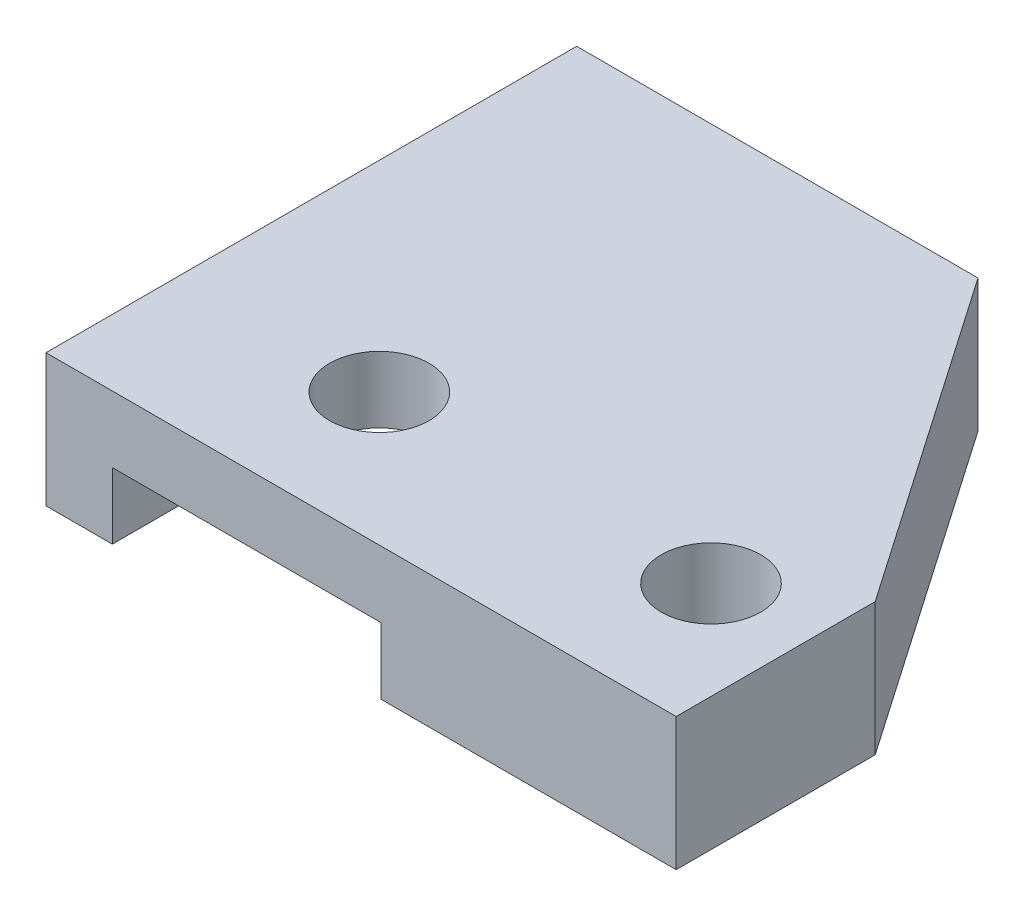
from build123d import *

# Parameters (mm, degrees)
BOSS_EXTRU_1_DEPTH      = 16
ESQUISSE2_R             = 1.5
ENL_V_MAT_EXTRU_1_DEPTH = 26.159491251


with BuildPart() as part:
    # Esquisse1 → Boss.-Extru.1 (new body)
    with BuildSketch(Plane.XY):
        Polygon((10.1, -4), (19, -4), (19, 0), (0, 0), (0, -4), (2, -4), (2, -2), (10.1, -2), align=None)
    extrude(amount=BOSS_EXTRU_1_DEPTH)

    # Esquisse2 → Enlèv. mat.-Extru.1 (cut, through all)
    with BuildSketch(Plane(origin=(0, 0, 0), x_dir=(1, 0, 0), z_dir=(0, 1, 0))):
        with Locations(Location((6.05, -12, 0), (0, 0, 270))):
            Circle(ESQUISSE2_R)
        with Locations(Location((16.05, -12, 0), (0, 0, 270))):
            Circle(ESQUISSE2_R)
        Polygon((12.1, 0), (19, 0), (19, -10), align=None)
    extrude(amount=-ENL_V_MAT_EXTRU_1_DEPTH, mode=Mode.SUBTRACT)


solid = part.part
